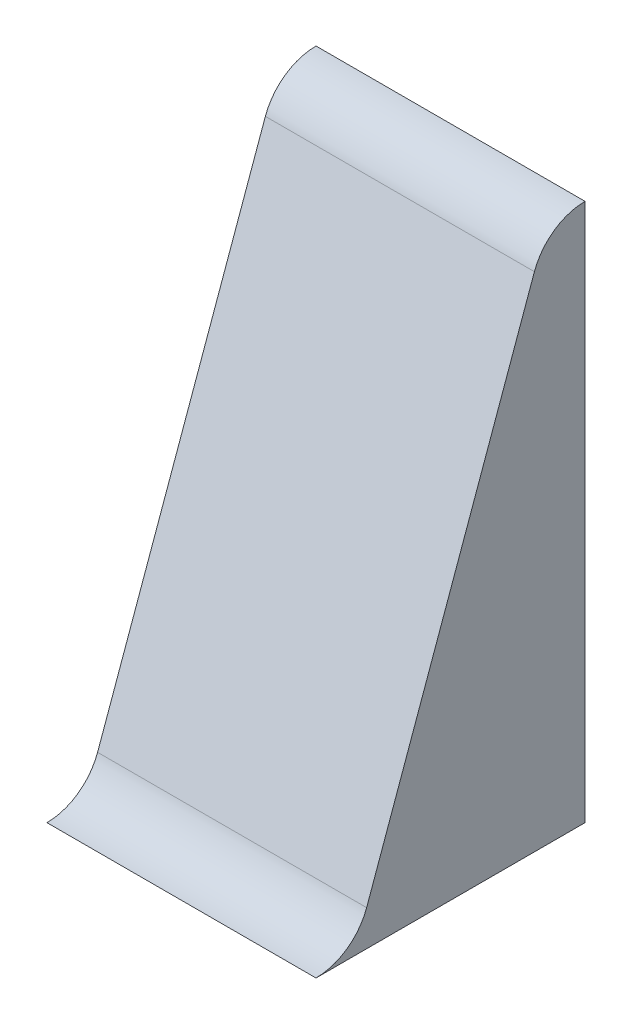
from build123d import *

# Parameters (mm, degrees)
AUFSATZ_LINEAR_AUSTRAGEN1_DEPTH = 1000


with BuildPart() as part:
    # Skizze1 → Aufsatz-Linear austragen1 (new body)
    with BuildSketch(Plane(origin=(0, 0, 0), x_dir=(0, 0, -1), z_dir=(1, 0, 0))):
        with BuildLine():
            Line((0, 0), (1000, 0))
            Line((1000, 0), (1000, 2000))
            ThreePointArc((1000, 2000), (884.950154707, 1963.595638995), (811.783470431, 1867.635330981))
            Line((811.783470431, 1867.635330981), (188.216529569, 132.364669019))
            ThreePointArc((188.216529569, 132.364669019), (115.049845293, 36.404361005), (0, 0))
        make_face()
    extrude(amount=AUFSATZ_LINEAR_AUSTRAGEN1_DEPTH)


solid = part.part
